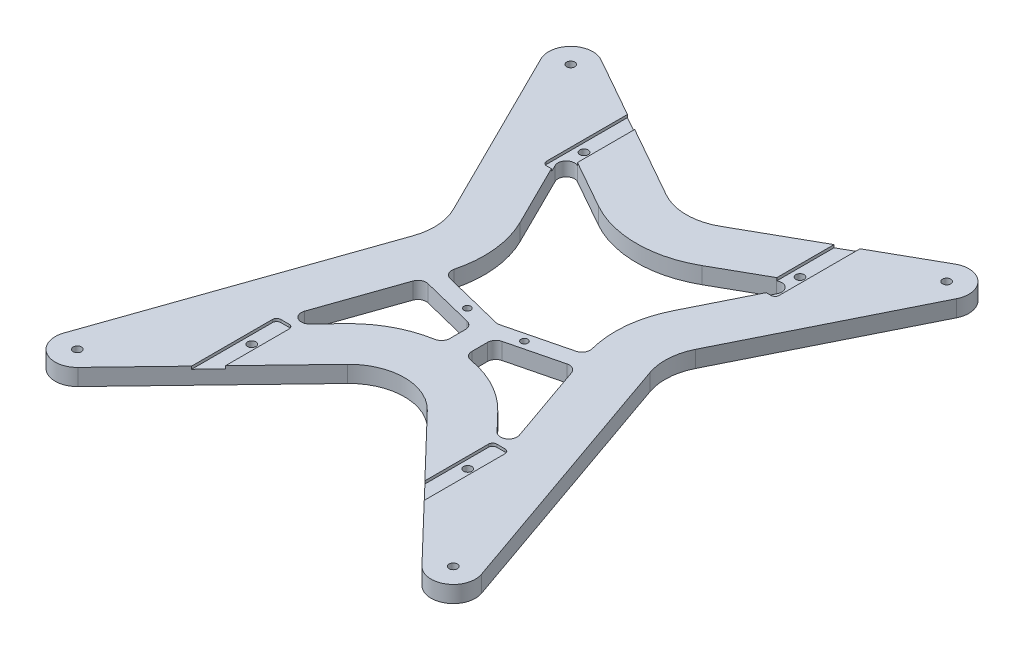
from build123d import *

# Parameters (mm, degrees)
SKETCH1_R           = 1.5
BOSS_EXTRUDE1_DEPTH = 6
FILLET1_R           = 20
CUT_EXTRUDE1_REACH  = 125.376
SKETCH5_R           = 1.25
BOSS_EXTRUDE2_DEPTH = 6
FILLET2_R           = 3
SKETCH6_W           = 6
SKETCH6_H           = 30.707123962
SKETCH6_H_2         = 30.684410161
CUT_EXTRUDE2_DEPTH  = 1
FILLET3_R           = 1.5


with BuildPart() as part:
    # Sketch1 → Boss-Extrude1 (new body)
    with BuildSketch(Plane(origin=(0, 0, 0), x_dir=(1, 0, 0), z_dir=(0, 1, 0))):
        with BuildLine():
            Line((-63.952675545, 96.063842822), (0, 60))
            Line((0, 60), (63.952675545, 96.063842822))
            ThreePointArc((63.952675545, 96.063842822), (73.389179934, 94.898361774), (75.046634262, 85.5357336))
            Line((75.046634262, 85.5357336), (40, 15))
            Line((40, 15), (75.434864258, -86.457646081))
            ThreePointArc((75.434864258, -86.457646081), (72.068849374, -95.912520808), (62.113867032, -94.638535384))
            Line((62.113867032, -94.638535384), (0, -30))
            Line((0, -30), (-62.113867032, -94.638535384))
            ThreePointArc((-62.113867032, -94.638535384), (-72.068849374, -95.912520808), (-75.434864258, -86.457646081))
            Line((-75.434864258, -86.457646081), (-40, 15))
            Line((-40, 15), (-75.046634262, 85.5357336))
            ThreePointArc((-75.046634262, 85.5357336), (-73.389179934, 94.898361774), (-63.952675545, 96.063842822))
        make_face()
        with Locations(Location((-67.882250994, 89.09545443, 0), (0, 0, 270))):
            Circle(SKETCH1_R, mode=Mode.SUBTRACT)
        with Locations(Location((67.882250994, 89.09545443, 0), (0, 0, 270))):
            Circle(SKETCH1_R, mode=Mode.SUBTRACT)
        with Locations(Location((-67.882250994, -89.09545443, 0), (0, 0, 270))):
            Circle(SKETCH1_R, mode=Mode.SUBTRACT)
        with Locations(Location((67.882250994, -89.09545443, 0), (0, 0, 270))):
            Circle(SKETCH1_R, mode=Mode.SUBTRACT)
        with Locations(Location((-39, 65, 0), (0, 0, 270))):
            Circle(SKETCH1_R, mode=Mode.SUBTRACT)
        with Locations(Location((39, 65, 0), (0, 0, 270))):
            Circle(SKETCH1_R, mode=Mode.SUBTRACT)
        with Locations(Location((39, -55, 0), (0, 0, 270))):
            Circle(SKETCH1_R, mode=Mode.SUBTRACT)
        with Locations(Location((-39, -55, 0), (0, 0, 270))):
            Circle(SKETCH1_R, mode=Mode.SUBTRACT)
    extrude(amount=BOSS_EXTRUDE1_DEPTH)

    # Fillet1
    fillet1_edges = [part.edges().sort_by_distance(p)[0] for p in [
        (0, 3, -60),
        (40, 3, -15),
        (0, 3, 30),
        (-40, 3, -15),
    ]]
    fillet(fillet1_edges, radius=FILLET1_R)

    # Sketch2 → Cut-Extrude1 (cut, up to next)
    with BuildSketch(Plane(origin=(0, 6, 0), x_dir=(1, 0, 0), z_dir=(0, 1, 0)), mode=Mode.PRIVATE) as cut_extrude1_sk1:
        with BuildLine():
            Line((-44.444795008, 64.398316163), (-27.62775586, 30.551922116))
            ThreePointArc((-27.62775586, 30.551922116), (-23.732915732, 16.019014171), (-25.78366338, 1.113658522))
            Line((-25.78366338, 1.113658522), (-43.323179503, -49.105752685))
            Line((-43.323179503, -49.105752685), (-27.39982382, -32.535179334))
            ThreePointArc((-27.39982382, -32.535179334), (0, -20.864813867), (27.39982382, -32.535179334))
            Line((27.39982382, -32.535179334), (43.323179503, -49.105752685))
            Line((43.323179503, -49.105752685), (25.78366338, 1.113658522))
            ThreePointArc((25.78366338, 1.113658522), (23.732915732, 16.019014171), (27.62775586, 30.551922116))
            Line((27.62775586, 30.551922116), (44.444795008, 64.398316163))
            Line((44.444795008, 64.398316163), (18.665483383, 49.860987824))
            ThreePointArc((18.665483383, 49.860987824), (0, 44.96083269), (-18.665483383, 49.860987824))
            Line((-18.665483383, 49.860987824), (-44.444795008, 64.398316163))
        make_face()
    cut_extrude1_tool1 = extrude(cut_extrude1_sk1.sketch, amount=-CUT_EXTRUDE1_REACH, mode=Mode.PRIVATE) & part.part
    add(cut_extrude1_tool1.solids().sort_by_distance((0, 6, -11.306472))[0], mode=Mode.SUBTRACT)

    # Sketch5 → Boss-Extrude2 (add)
    with BuildSketch(Plane(origin=(0, 6, 0), x_dir=(1, 0, 0), z_dir=(0, 1, 0))):
        with BuildLine():
            Line((-26.321862123, 1.247557887), (0, -5.301102183))
            Line((0, -5.301102183), (26.321862123, 1.247557887))
            Line((26.321862123, 1.247557887), (27.770453283, -4.57494876))
            Line((27.770453283, -4.57494876), (4, -10.488839561))
            Line((4, -10.488839561), (4, -21.075926612))
            ThreePointArc((4, -21.075926612), (0, -20.864813867), (-4, -21.075926612))
            Line((-4, -21.075926612), (-4, -10.488839561))
            Line((-4, -10.488839561), (-27.770453283, -4.57494876))
            Line((-27.770453283, -4.57494876), (-26.321862123, 1.247557887))
        make_face()
        with Locations(Location((-10.3, -5.83, 0), (0, 0, 270))):
            Circle(SKETCH5_R, mode=Mode.SUBTRACT)
        with Locations(Location((10.3, -5.83, 0), (0, 0, 270))):
            Circle(SKETCH5_R, mode=Mode.SUBTRACT)
    extrude(amount=-BOSS_EXTRUDE2_DEPTH)

    # Fillet2
    fillet2_edges = [part.edges().sort_by_distance(p)[0] for p in [
        (-44.444795008, 3, -64.398316163),
        (44.444795008, 3, -64.398316163),
        (25.78366338, 3, -1.113658522),
        (43.323179503, 3, 49.105752685),
        (-43.323179503, 3, 49.105752685),
        (-25.78366338, 3, -1.113658522),
        (0, 3, 5.301102183),
        (-4, 3, 10.488839561),
        (-4, 3, 21.075926612),
        (4, 3, 21.075926612),
        (4, 3, 10.488839561),
        (27.770453283, 3, 4.57494876),
        (-27.770453283, 3, 4.57494876),
    ]]
    fillet(fillet2_edges, radius=FILLET2_R)

    # Sketch6 → Cut-Extrude2 (cut)
    with BuildSketch(Plane(origin=(0, 6, 0), x_dir=(1, 0, 0), z_dir=(0, 1, 0))):
        with Locations((-39, -58.353561981)):
            Rectangle(SKETCH6_W, SKETCH6_H)
        with Locations((39, -58.353561981)):
            Rectangle(SKETCH6_W, SKETCH6_H)
        with Locations((39, 68.342205081)):
            Rectangle(SKETCH6_W, SKETCH6_H_2)
        with Locations((-39, 68.342205081)):
            Rectangle(SKETCH6_W, SKETCH6_H_2)
    extrude(amount=-CUT_EXTRUDE2_DEPTH, mode=Mode.SUBTRACT)

    # Fillet3
    fillet3_edges = [part.edges().sort_by_distance(p)[0] for p in [
        (-36, 5.5, 43),
        (-42, 5.5, 43),
        (36, 5.5, 43),
        (42, 5.5, 43),
        (42, 5.5, -53),
        (-42, 5.5, -53),
    ]]
    fillet(fillet3_edges, radius=FILLET3_R)


solid = part.part
